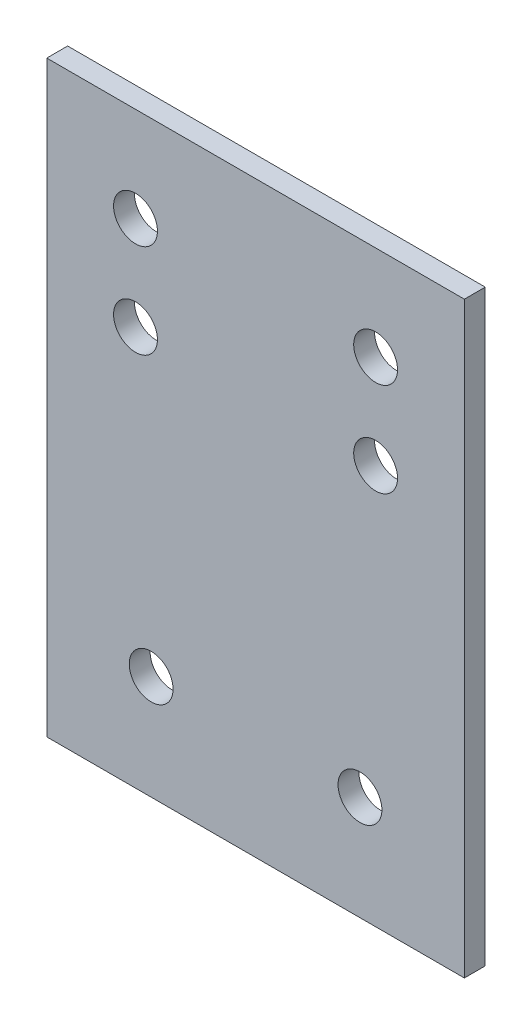
from build123d import *

# Parameters (mm, degrees)
SKETCH1_W            = 80
SKETCH1_H            = 112.623622543
BOSS_EXTRUDE1_DEPTH  = 4
M8_CLEARANCE_HOLE1_D = 8.4


with BuildPart() as part:
    # Sketch1 → Boss-Extrude1 (new body)
    with BuildSketch(Plane.XY):
        with Locations((-1780.42117355, -1805.607597845)):
            Rectangle(SKETCH1_W, SKETCH1_H)
    extrude(amount=BOSS_EXTRUDE1_DEPTH)

    # M8 Clearance Hole1 (through all)
    with Locations(Plane.XY.offset(4)):
        with Locations((-1760.42117355, -1841.919409116), (-1803.421173548, -1767.419409116), (-1800.42117355, -1841.919409116), (-1757.421173548, -1785.419409116), (-1757.421173548, -1767.419409116), (-1803.421173548, -1785.419409116)):
            Hole(M8_CLEARANCE_HOLE1_D / 2)


solid = part.part
